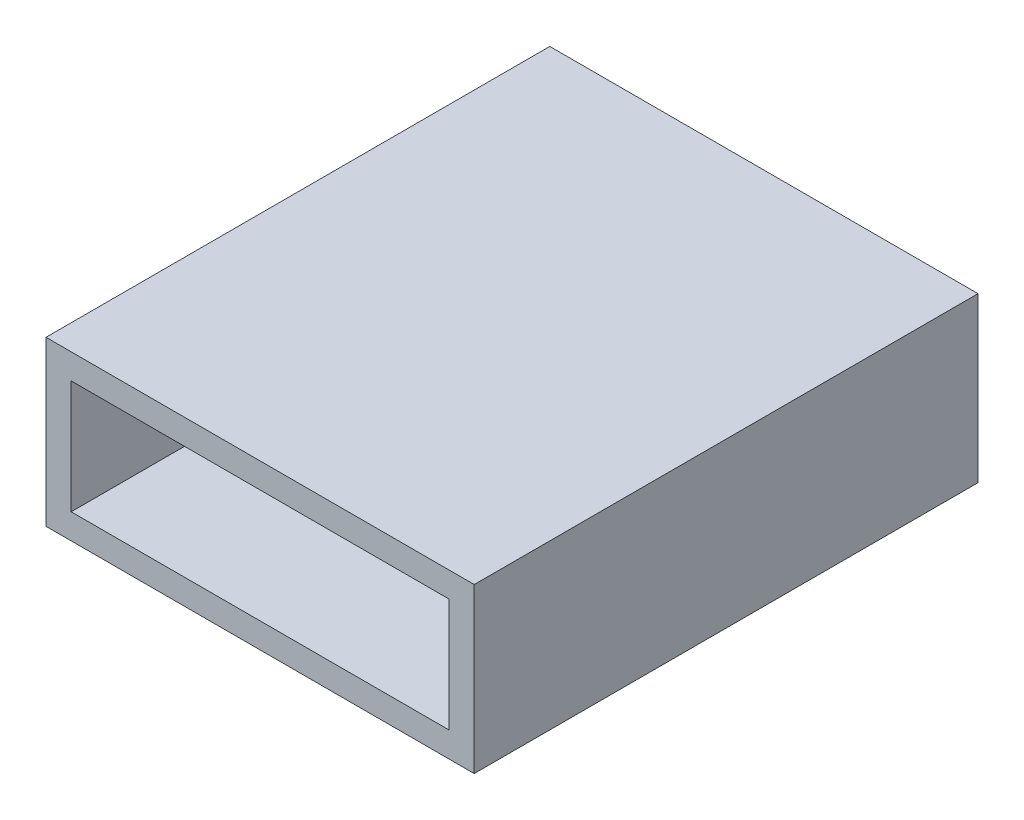
from build123d import *

# Parameters (mm, degrees)
SKETCH1_W           = 30
SKETCH1_H           = 9
BOSS_EXTRUDE1_DEPTH = 4
SKETCH2_W           = 34
SKETCH2_H           = 13
SKETCH2_W_2         = 30
SKETCH2_H_2         = 9
BOSS_EXTRUDE2_DEPTH = 36


with BuildPart() as part:
    # Sketch1 → Boss-Extrude1 (new body)
    with BuildSketch(Plane.XY):
        Polygon((-17, 6.5), (-17, -6.5), (-5.5, -6.5), (-5.5, -5.5), (5.5, -5.5), (5.5, -6.5), (17, -6.5), (17, 6.5), align=None)
        Rectangle(SKETCH1_W, SKETCH1_H, mode=Mode.SUBTRACT)
    extrude(amount=BOSS_EXTRUDE1_DEPTH)

    # Sketch2 → Boss-Extrude2 (add)
    with BuildSketch(Plane.XY.offset(4)):
        Rectangle(SKETCH2_W, SKETCH2_H)
        Rectangle(SKETCH2_W_2, SKETCH2_H_2, mode=Mode.SUBTRACT)
    extrude(amount=BOSS_EXTRUDE2_DEPTH)


solid = part.part
